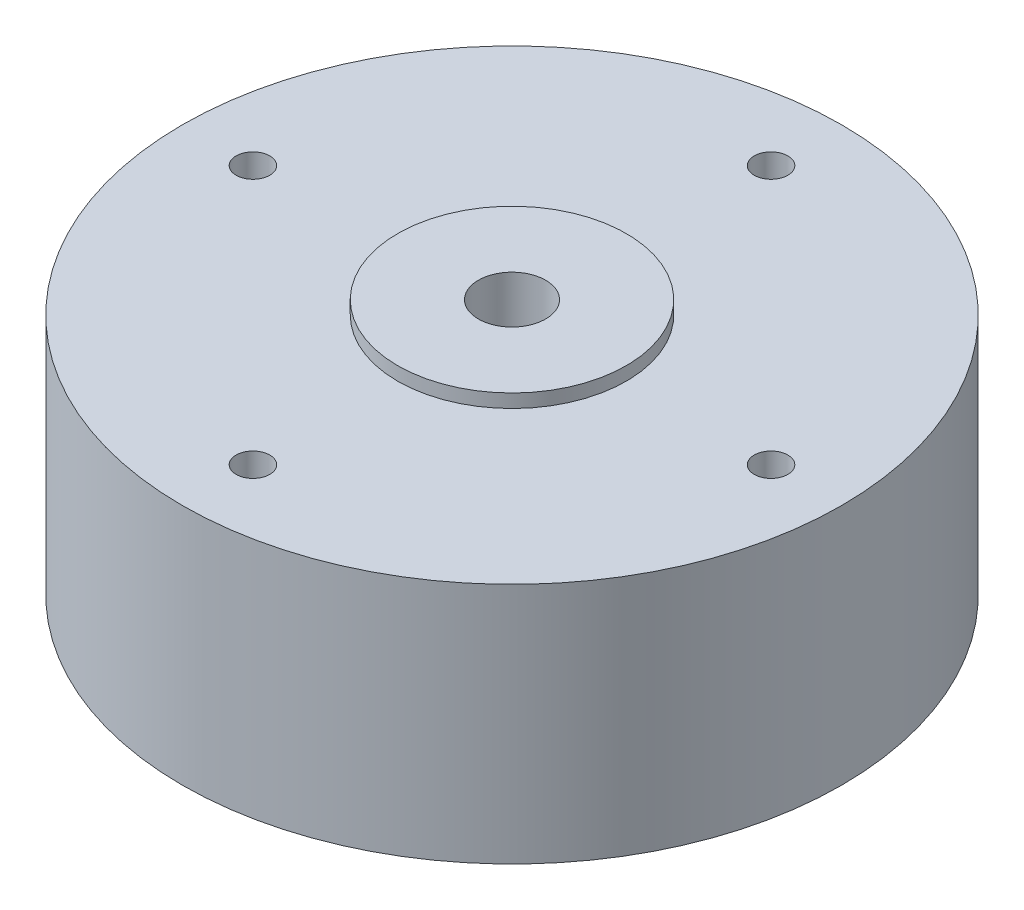
from build123d import *

# Parameters (mm, degrees)
SKETCH1_R      = 24.5
EXTRUDE1_DEPTH = 19
EXTRUDE2_START = -1
SKETCH2_R      = 24.5
SKETCH2_R_2    = 8.5
EXTRUDE2_DEPTH = 1
SKETCH3_R      = 1.25
EXTRUDE3_DEPTH = 4
SKETCH4_R      = 1.5
EXTRUDE4_DEPTH = 3
SKETCH6_R      = 2.5
EXTRUDE6_DEPTH = 40.515819617


with BuildPart() as part:
    # Sketch1 → Extrude1 (new body)
    with BuildSketch(Plane(origin=(0, 0, 0), x_dir=(1, 0, 0), z_dir=(0, 1, 0))):
        Circle(SKETCH1_R)
    extrude(amount=EXTRUDE1_DEPTH)

    # Sketch2 → Extrude2 (cut)
    with BuildSketch(Plane(origin=(0, 19, 0), x_dir=(1, 0, 0), z_dir=(0, 1, 0)).offset(EXTRUDE2_START)):
        Circle(SKETCH2_R)
        Circle(SKETCH2_R_2, mode=Mode.SUBTRACT)
    extrude(amount=EXTRUDE2_DEPTH, mode=Mode.SUBTRACT)

    # Sketch3 → Extrude3 (cut)
    with BuildSketch(Plane(origin=(0, 19, 0), x_dir=(1, 0, 0), z_dir=(0, 1, 0))):
        with Locations((0, 19.25)):
            Circle(SKETCH3_R)
        with Locations((19.25, 0)):
            Circle(SKETCH3_R)
        with Locations((0, -19.25)):
            Circle(SKETCH3_R)
        with Locations((-19.25, 0)):
            Circle(SKETCH3_R)
    extrude(amount=-EXTRUDE3_DEPTH, mode=Mode.SUBTRACT)

    # Sketch4 → Extrude4 (cut)
    with BuildSketch(Plane.XZ):
        with Locations((0, 12.5)):
            Circle(SKETCH4_R)
        with Locations((12.5, 0)):
            Circle(SKETCH4_R)
        with Locations((0, -12.5)):
            Circle(SKETCH4_R)
        with Locations((-12.5, 0)):
            Circle(SKETCH4_R)
    extrude(amount=-EXTRUDE4_DEPTH, mode=Mode.SUBTRACT)

    # Sketch6 → Extrude6 (cut, through all)
    with BuildSketch(Plane.XZ):
        Circle(SKETCH6_R)
    extrude(amount=-EXTRUDE6_DEPTH, mode=Mode.SUBTRACT)


solid = part.part
